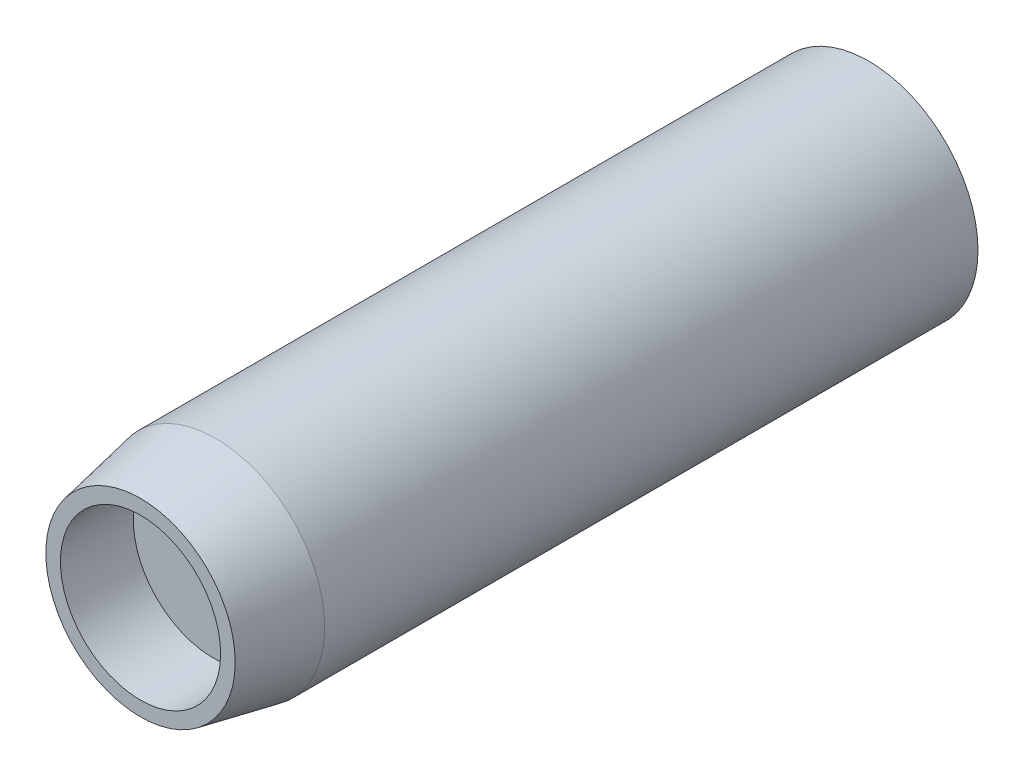
from build123d import *

# Parameters (mm, degrees)
SKETCH1_R           = 7.5
BOSS_EXTRUDE1_DEPTH = 50
SKETCH2_R           = 5.5
CUT_EXTRUDE1_DEPTH  = 5
CHAMFER1_SIZE       = 1
CHAMFER1_SIZE2      = 5.144554016


with BuildPart() as part:
    # Sketch1 → Boss-Extrude1 (new body)
    with BuildSketch(Plane.XY):
        Circle(SKETCH1_R)
    extrude(amount=BOSS_EXTRUDE1_DEPTH)

    # Sketch2 → Cut-Extrude1 (cut)
    with BuildSketch(Plane.XY.offset(50)):
        Circle(SKETCH2_R)
    extrude(amount=-CUT_EXTRUDE1_DEPTH, mode=Mode.SUBTRACT)

    # Chamfer1
    chamfer1_edges = [part.edges().sort_by_distance(p)[0] for p in [
        (-7.5, 0, 50),
    ]]
    chamfer1_side = [part.faces().sort_by_distance(p)[0] for p in [
        (-7.287867966, 0, 50),
    ]]
    chamfer(chamfer1_edges, length=CHAMFER1_SIZE, length2=CHAMFER1_SIZE2, reference=chamfer1_side[0])


solid = part.part
